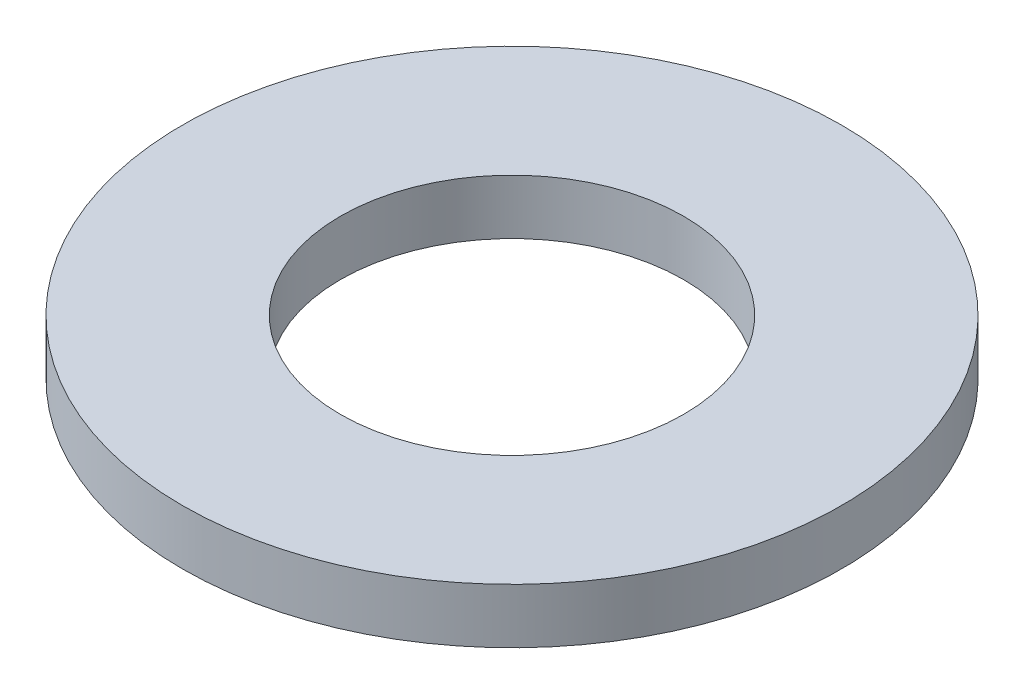
from build123d import *

# Parameters (mm, degrees)
SKETCH1_R           = 6
SKETCH1_R_2         = 3.125
BOSS_EXTRUDE1_DEPTH = 1


with BuildPart() as part:
    # Sketch1 → Boss-Extrude1 (new body)
    with BuildSketch(Plane(origin=(0, 0, 0), x_dir=(-1, 0, 0), z_dir=(0, 1, 0))):
        with Locations(Location((0, 0, 0), (0, 0, 90))):
            Circle(SKETCH1_R)
        with Locations(Location((0, 0, 0), (0, 0, 90))):
            Circle(SKETCH1_R_2, mode=Mode.SUBTRACT)
    extrude(amount=BOSS_EXTRUDE1_DEPTH)


solid = part.part
